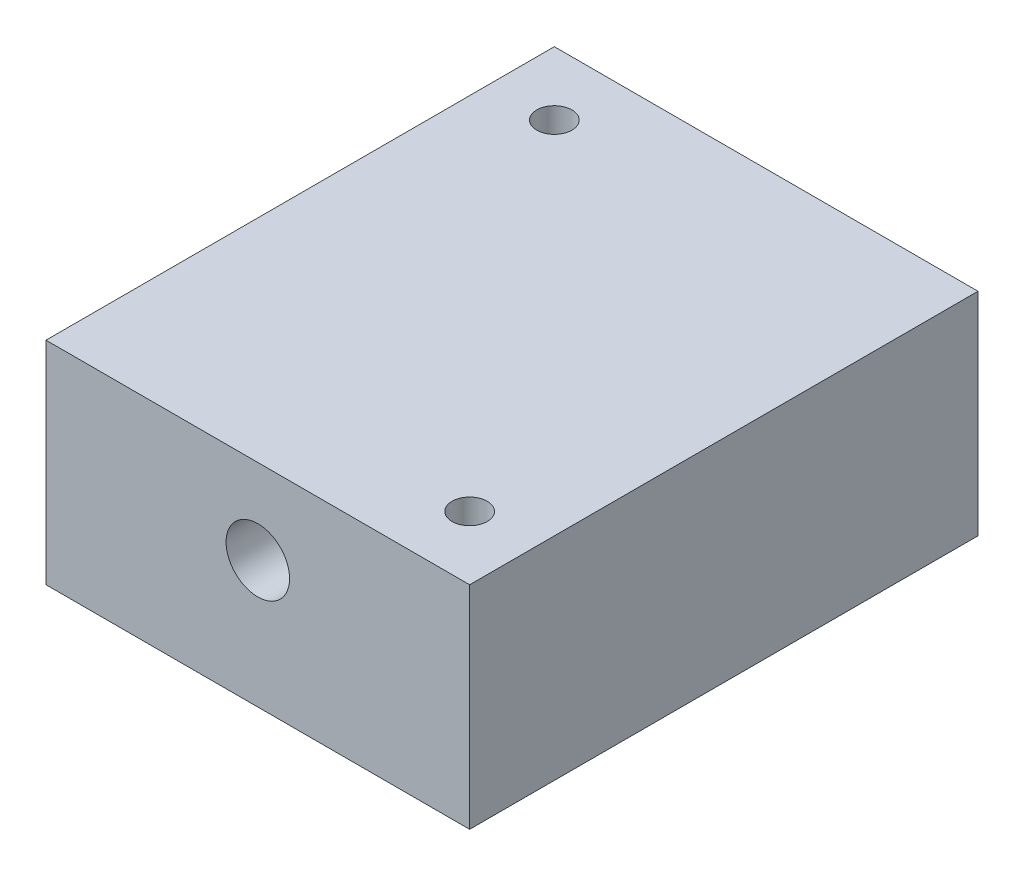
from build123d import *

# Parameters (mm, degrees)
SKIZZE1_W                                           = 100
SKIZZE1_H                                           = 50
AUFSATZ_LINEAR_AUSTRAGEN1_DEPTH                     = 120
KERNLOCH_F_R_M8_HELICOIL1_D                         = 8.3
KERNLOCH_F_R_M8_HELICOIL1_DEPTH                     = 20
KERNLOCH_F_R_M8_HELICOIL1_TIP                       = 2.493571569
STIRNSENKUNG_F_R_M8_SENKSCHRAUBE_KOPF_B_D           = 9
STIRNSENKUNG_F_R_M8_SENKSCHRAUBE_KOPF_B_CBORE_D     = 15
STIRNSENKUNG_F_R_M8_SENKSCHRAUBE_KOPF_B_CBORE_DEPTH = 116


with BuildPart() as part:
    # Skizze1 → Aufsatz-Linear austragen1 (new body)
    with BuildSketch(Plane.XY):
        Rectangle(SKIZZE1_W, SKIZZE1_H)
    extrude(amount=AUFSATZ_LINEAR_AUSTRAGEN1_DEPTH)

    # Kernloch für M8 Helicoil1
    with Locations(Plane(origin=(0, 25, 0), x_dir=(1, 0, 0), z_dir=(0, 1, 0))):
        with Locations((35, -105), (-35, -15)):
            Hole(KERNLOCH_F_R_M8_HELICOIL1_D / 2, depth=KERNLOCH_F_R_M8_HELICOIL1_DEPTH)
            with Locations((0, 0, -(KERNLOCH_F_R_M8_HELICOIL1_DEPTH + KERNLOCH_F_R_M8_HELICOIL1_TIP / 2))):  # 118° drill point
                Cone(0, KERNLOCH_F_R_M8_HELICOIL1_D / 2, KERNLOCH_F_R_M8_HELICOIL1_TIP, mode=Mode.SUBTRACT)

    # Stirnsenkung für M8 Senkschraube (Kopf Button)1 (through all)
    with Locations(Plane.XY.offset(120)):
        with Locations((4.444e-06, 5)):
            CounterBoreHole(STIRNSENKUNG_F_R_M8_SENKSCHRAUBE_KOPF_B_D / 2, STIRNSENKUNG_F_R_M8_SENKSCHRAUBE_KOPF_B_CBORE_D / 2, STIRNSENKUNG_F_R_M8_SENKSCHRAUBE_KOPF_B_CBORE_DEPTH)


solid = part.part
